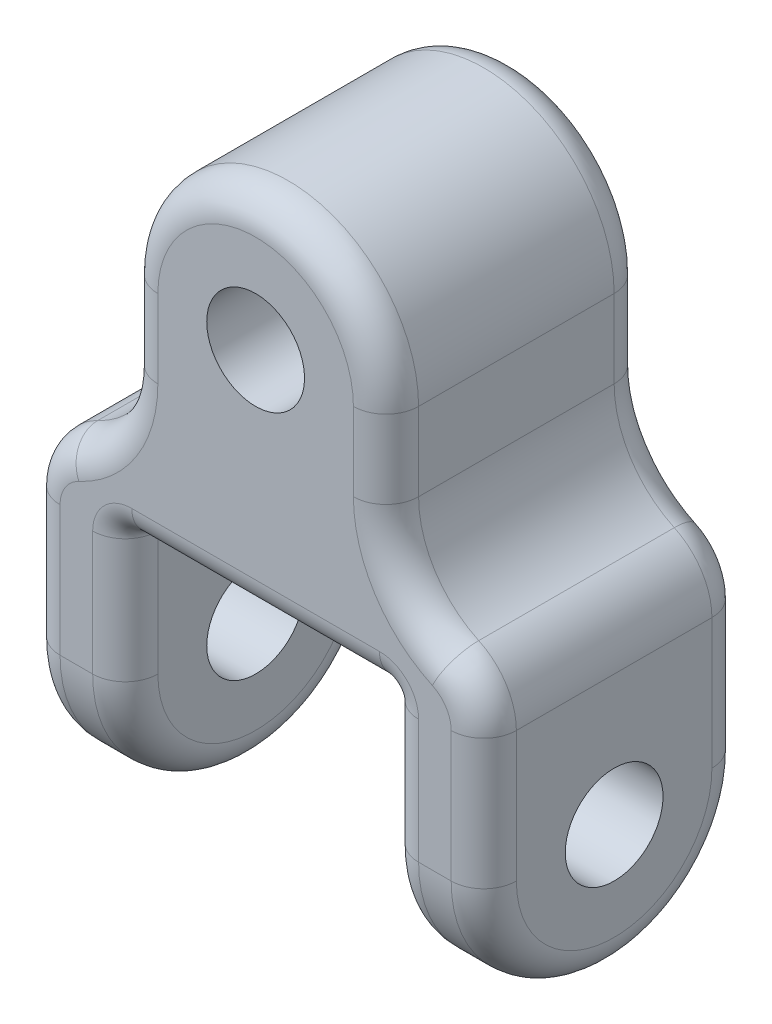
from build123d import *

# Parameters (mm, degrees)
BOSS_EXTRUDE1_DEPTH     = 60
FILLET2_RADIUS          = 30
FILLET2_LENGTH          = 22.5
FILLET3_RADIUS          = 30
FILLET3_LENGTH          = 22.5
CUT_EXTRUDE1_DEPTH      = 188.538486464
CUT_EXTRUDE1_DEPTH_BACK = 188.538486464
SKETCH2_R               = 11.25
SKETCH3_R               = 11.25
CUT_EXTRUDE2_DEPTH      = 165.018090176
FILLET4_R               = 1.5
FILLET6_R               = 7.5


with BuildPart() as part:
    # Sketch1 → Boss-Extrude1 (new body)
    with BuildSketch(Plane.XY):
        with BuildLine():
            Line((-30, 60), (-30, 0))
            Line((-30, 0), (-52.5, 0))
            Line((-52.5, 0), (-52.5, 60))
            ThreePointArc((-52.5, 60), (-50.152910884, 68.056292333), (-43.846153846, 73.591406526))
            ThreePointArc((-43.846153846, 73.591406526), (-33.755342585, 82.447589235), (-30, 95.337656968))
            Line((-30, 95.337656968), (-30, 113.337656968))
            ThreePointArc((-30, 113.337656968), (0, 143.337656968), (30, 113.337656968))
            Line((30, 113.337656968), (30, 95.337656968))
            ThreePointArc((30, 95.337656968), (33.755342585, 82.447589235), (43.846153846, 73.591406526))
            ThreePointArc((43.846153846, 73.591406526), (50.152910884, 68.056292333), (52.5, 60))
            Line((52.5, 60), (52.5, 0))
            Line((52.5, 0), (30, 0))
            Line((30, 0), (30, 60))
            Line((30, 60), (-30, 60))
        make_face()
    extrude(amount=BOSS_EXTRUDE1_DEPTH)

    # Fillet2: full round fillet: the end face becomes a half cylinder, R = half its width
    fillet2_face = Plane((41.25, 0, 30), x_dir=(-1, 0, 0), z_dir=(0, -1, 0))  # on the end face: x along it, z out of the body
    fillet2_slab = fillet2_face.offset(-FILLET2_RADIUS / 2) * Box(FILLET2_LENGTH, 2 * FILLET2_RADIUS, FILLET2_RADIUS, mode=Mode.PRIVATE)  # the body's end, R deep
    fillet2_round = Plane((41.25, 30, 30), x_dir=(0, -1, 0), z_dir=(-1, 0, 0)) * Cylinder(FILLET2_RADIUS, FILLET2_LENGTH, mode=Mode.PRIVATE)  # its axis R under the face
    add(fillet2_slab - fillet2_round, mode=Mode.SUBTRACT)

    # Fillet3: full round fillet: the end face becomes a half cylinder, R = half its width
    fillet3_face = Plane((-41.25, 0, 30), x_dir=(1, 0, 0), z_dir=(0, -1, 0))  # on the end face: x along it, z out of the body
    fillet3_slab = fillet3_face.offset(-FILLET3_RADIUS / 2) * Box(FILLET3_LENGTH, 2 * FILLET3_RADIUS, FILLET3_RADIUS, mode=Mode.PRIVATE)  # the body's end, R deep
    fillet3_round = Plane((-41.25, 30, 30), x_dir=(0, -1, 0), z_dir=(1, 0, 0)) * Cylinder(FILLET3_RADIUS, FILLET3_LENGTH, mode=Mode.PRIVATE)  # its axis R under the face
    add(fillet3_slab - fillet3_round, mode=Mode.SUBTRACT)

    # Sketch2 → Cut-Extrude1 (cut, two sides: drawn at the far end of the back side and taken through both)
    with BuildSketch(Plane(origin=(52.5, 0, 0), x_dir=(0, 0, -1), z_dir=(1, 0, 0)).offset(-CUT_EXTRUDE1_DEPTH_BACK)):
        with Locations(Location((-30, 30, 0), (0, 0, 90))):
            Circle(SKETCH2_R)
    extrude(amount=CUT_EXTRUDE1_DEPTH + CUT_EXTRUDE1_DEPTH_BACK, mode=Mode.SUBTRACT)

    # Sketch3 → Cut-Extrude2 (cut, through all)
    with BuildSketch(Plane(origin=(0, 0, 0), x_dir=(-1, 0, 0), z_dir=(0, 0, -1))):
        with Locations((0, 113.337656968)):
            Circle(SKETCH3_R)
    extrude(amount=-CUT_EXTRUDE2_DEPTH, mode=Mode.SUBTRACT)

    # Fillet4
    fillet4_edges = [part.edges().sort_by_distance(p)[0] for p in [
        (-30, 60, 30),
        (30, 60, 30),
    ]]
    fillet(fillet4_edges, radius=FILLET4_R)

    # Fillet6
    fillet6_edges = [part.edges().sort_by_distance(p)[0] for p in [
        (-52.5, 45, 0),
        (-50.152910884, 68.056292333, 0),
        (-33.755342585, 82.447589235, 0),
        (-30, 104.337656968, 0),
        (0, 143.337656968, 0),
        (30, 104.337656968, 0),
        (33.755342585, 82.447589235, 0),
        (50.152910884, 68.056292333, 60),
        (50.152910884, 68.056292333, 0),
        (33.755342585, 82.447589235, 60),
        (30, 104.337656968, 60),
        (0, 143.337656968, 60),
        (-30, 104.337656968, 60),
        (-33.755342585, 82.447589235, 60),
        (-50.152910884, 68.056292333, 60),
        (-52.5, 45, 60),
        (52.5, 45, 60),
        (52.5, 45, 0),
        (30, 0, 30),
        (52.5, 0, 30),
        (-30, 44.25, 0),
        (-30, 44.25, 60),
        (-30, 0, 30),
        (-52.5, 0, 30),
        (0, 60, 0),
        (0, 60, 60),
        (30, 44.25, 0),
        (30, 44.25, 60),
        (-29.560660172, 59.560660172, 0),
        (-29.560660172, 59.560660172, 60),
        (29.560660172, 59.560660172, 0),
        (29.560660172, 59.560660172, 60),
    ]]
    fillet(fillet6_edges, radius=FILLET6_R)


solid = part.part
